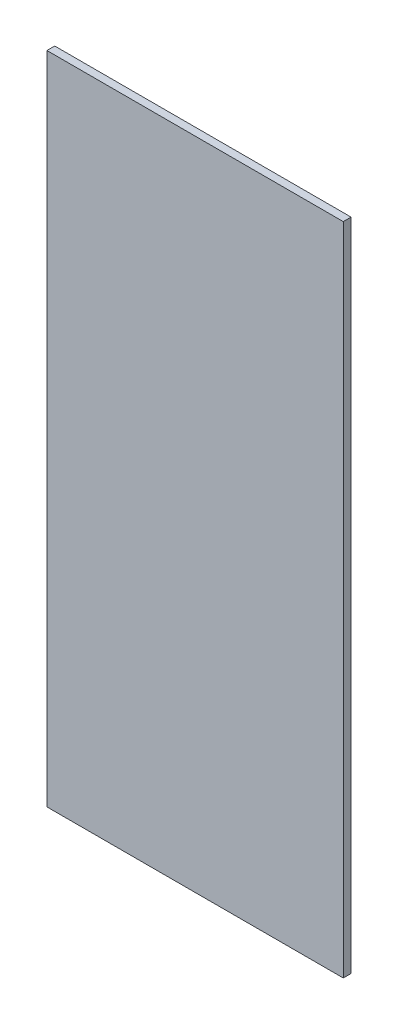
from build123d import *

# Parameters (mm, degrees)
ESQUISSE1_W        = 190
ESQUISSE1_H        = 420
BOSS_EXTRU_1_DEPTH = 5


with BuildPart() as part:
    # Esquisse1 → Boss.-Extru.1 (new body)
    with BuildSketch(Plane.XY):
        Rectangle(ESQUISSE1_W, ESQUISSE1_H)
    extrude(amount=BOSS_EXTRU_1_DEPTH)


solid = part.part
